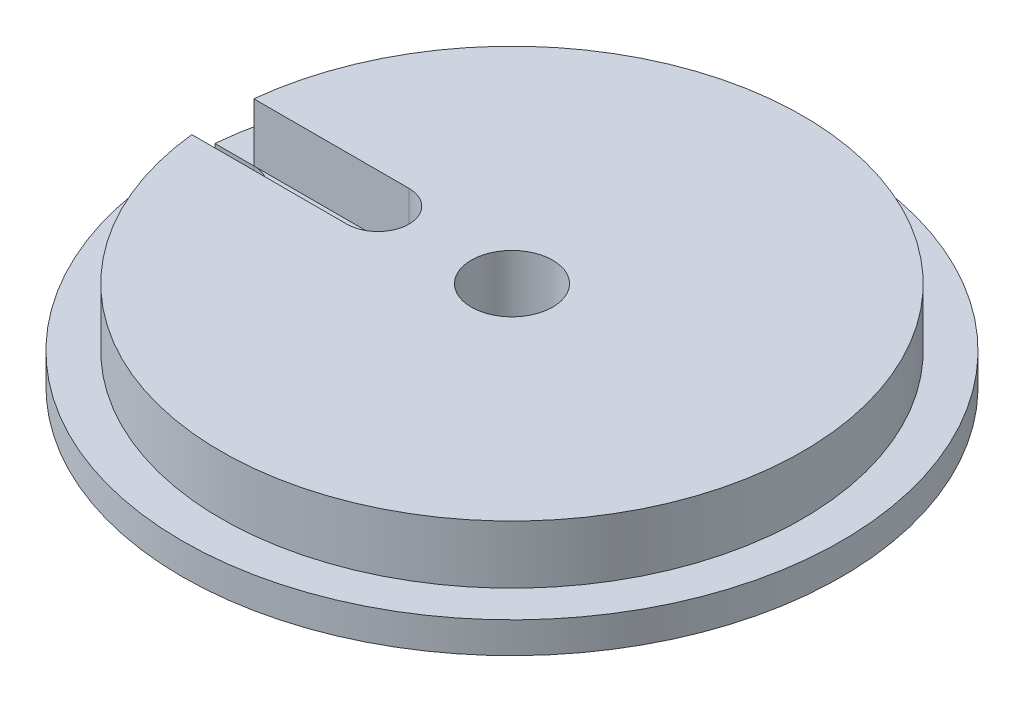
from build123d import *

# Parameters (mm, degrees)
SKETCH_1_R          = 15
SKETCH_1_R_2        = 2.1
EXTRUDE_1_DEPTH     = 3
CUT_EXTRUDE_1_DEPTH = 10
SKETCH_3_R          = 1.6
SKETCH_3_R_2        = 2.1
EXTRUDE_2_DEPTH     = 1.6


with BuildPart() as part:
    # ｽｹｯﾁ1 → ﾎﾞｽ - 押し出し1 (new body)
    with BuildSketch(Plane(origin=(0, 0, 0), x_dir=(1, 0, 0), z_dir=(0, 1, 0))):
        with Locations(Location((0, 0, 0), (0, 0, 270))):
            Circle(SKETCH_1_R)
        with Locations(Location((0, 0, 0), (0, 0, 270))):
            Circle(SKETCH_1_R_2, mode=Mode.SUBTRACT)
    extrude(amount=EXTRUDE_1_DEPTH)

    # ｽｹｯﾁ2 → ｶｯﾄ - 押し出し1 (cut)
    with BuildSketch(Plane(origin=(0, 3, 0), x_dir=(1, 0, 0), z_dir=(0, 1, 0))):
        with BuildLine():
            Line((-14.91442255, 1.6), (-6.91442255, 1.6))
            ThreePointArc((-6.91442255, 1.6), (-5.31442255, 0), (-6.91442255, -1.6))
            Line((-6.91442255, -1.6), (-14.91442255, -1.6))
            ThreePointArc((-14.91442255, -1.6), (-16.51442255, 0), (-14.91442255, 1.6))
        make_face()
    extrude(amount=-CUT_EXTRUDE_1_DEPTH, mode=Mode.SUBTRACT)

    # ｽｹｯﾁ3 → ﾎﾞｽ - 押し出し2 (add)
    with BuildSketch(Plane.XZ):
        with BuildLine():
            Line((-16.924538398, -1.6), (-14.91442255, -1.6))
            ThreePointArc((-14.91442255, -1.6), (-13.31442255, 0), (-14.91442255, 1.6))
            Line((-14.91442255, 1.6), (-16.924538398, 1.6))
            ThreePointArc((-16.924538398, 1.6), (17, 0), (-16.924538398, -1.6))
        make_face()
        with Locations(Location((-6.91442255, 0, 0), (0, 0, 270))):
            Circle(SKETCH_3_R, mode=Mode.SUBTRACT)
        with Locations(Location((0, 0, 0), (0, 0, 270))):
            Circle(SKETCH_3_R_2, mode=Mode.SUBTRACT)
    extrude(amount=EXTRUDE_2_DEPTH)


solid = part.part
